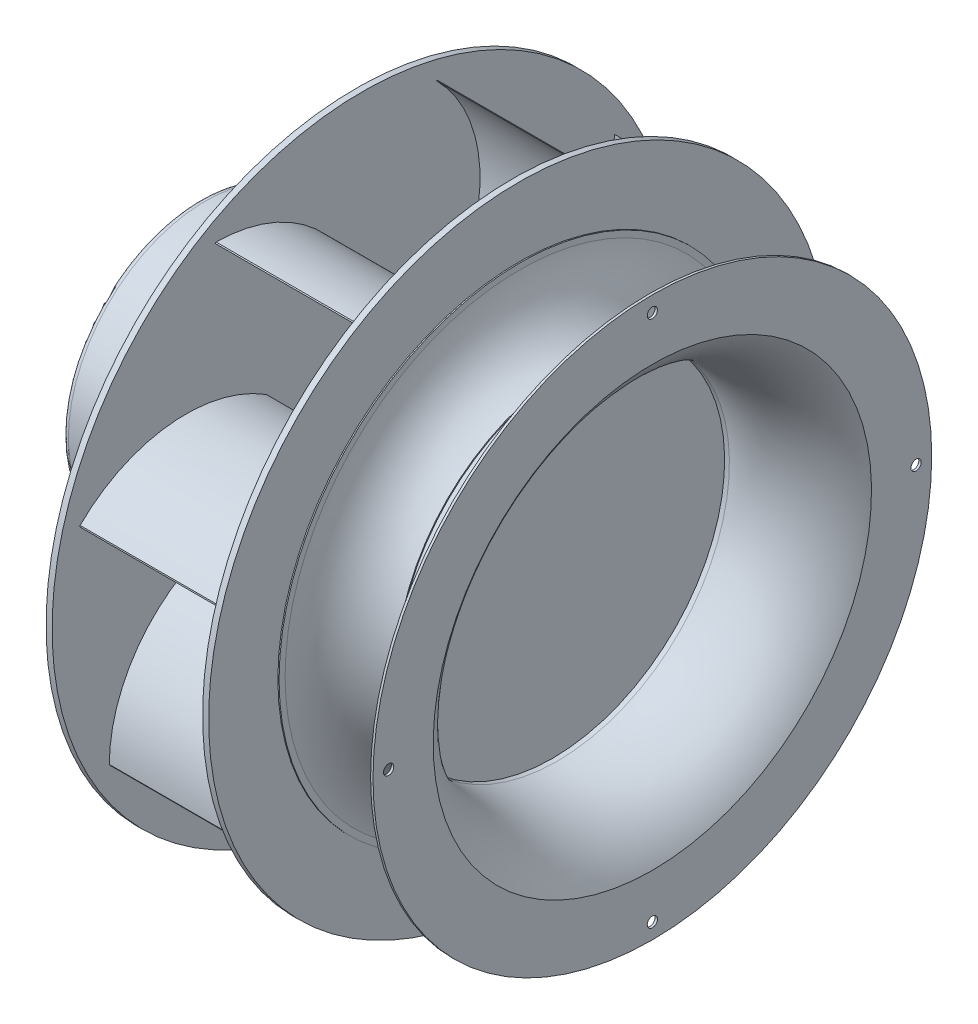
from build123d import *

# Parameters (mm, degrees)
SKETCH2_R         = 257.5
EXTRUDE1_DEPTH    = 5
SKETCH9_R         = 252.5
SKETCH9_R_2       = 100
EXTRUDE7_DEPTH    = 3
SKETCH3_R         = 257.5
EXTRUDE2_DEPTH    = 5
EXTRUDE3_DEPTH    = 130
CIRPATTERN1_COUNT = 8
SKETCH7_R         = 4.25
EXTRUDE5_DEPTH    = 5
CIRPATTERN2_COUNT = 4
SKETCH8_R         = 5
EXTRUDE6_DEPTH    = 90
CIRPATTERN3_COUNT = 8


with BuildPart() as part:
    # Sketch1 → Revolve1 (revolve)
    with BuildSketch(Plane.XY, mode=Mode.PRIVATE) as revolve1_sk:
        with BuildLine():
            Line((0, 0), (0, 109))
            ThreePointArc((0, 109), (1.464466094, 112.535533906), (5, 114))
            Line((5, 114), (70, 114))
            Line((70, 114), (70, 138))
            Line((70, 138), (90, 138))
            Line((90, 138), (90, 98))
            Line((90, 98), (95, 98))
            Line((95, 98), (95, 133))
            Line((95, 133), (105, 133))
            Line((105, 133), (105, 98))
            Line((105, 98), (130, 98))
            Line((130, 98), (130, 0))
            Line((130, 0), (0, 0))
        make_face()
    revolve(revolve1_sk.sketch.rotate(Axis((0, 0, 0), (1, 0, 0)), 90), axis=Axis((0, 0, 0), (1, 0, 0)))

    # Sketch2 → Extrude1 (add)
    with BuildSketch(Plane(origin=(130, 0, 0), x_dir=(0, 0, -1), z_dir=(1, 0, 0))):
        Circle(SKETCH2_R)
    extrude(amount=EXTRUDE1_DEPTH)

    # Sketch9 → Extrude7 (cut)
    with BuildSketch(Plane.ZY.offset(-130)):
        Circle(SKETCH9_R)
        Circle(SKETCH9_R_2, mode=Mode.SUBTRACT)
    extrude(amount=-EXTRUDE7_DEPTH, mode=Mode.SUBTRACT)



with BuildPart() as body_2:
    # Sketch3 → Extrude2 (new body)
    with BuildSketch(Plane(origin=(260, 0, 0), x_dir=(0, 0, -1), z_dir=(1, 0, 0))):
        Circle(SKETCH3_R)
    extrude(amount=EXTRUDE2_DEPTH)


with BuildPart() as part_1:
    add(part.part)

    add(body_2.part)  # Extrude3 merges body 2
    # Sketch4 → Extrude3 (add)
    with BuildSketch(Plane(origin=(135, 0, 0), x_dir=(0, 0, -1), z_dir=(1, 0, 0))):
        with BuildLine():
            Line((-121.25, 210.011160418), (-122.116025404, 209.511160418))
            ThreePointArc((-122.116025404, 209.511160418), (-44.469436379, 181.921031018), (-0.866025404, 112))
            Line((-0.866025404, 112), (0, 112.5))
            ThreePointArc((0, 112.5), (-43.603410976, 182.421031018), (-121.25, 210.011160418))
        make_face()
    extrude3 = extrude(amount=EXTRUDE3_DEPTH)

    # CirPattern1: Extrude3 ×8 about axis
    cirpattern1_axis = Axis((0, 0, 0), (1, 0, 0))
    for i in range(1, CIRPATTERN1_COUNT):
        add(extrude3.rotate(cirpattern1_axis, i * 360 / CIRPATTERN1_COUNT))

    # Sketch5 → Revolve2 (revolve)
    with BuildSketch(Plane.XY, mode=Mode.PRIVATE) as revolve2_sk:
        with BuildLine():
            Line((265, 200), (266, 200))
            Line((266, 200), (266, 195))
            ThreePointArc((266, 195), (280.264553623, 164.150526649), (309, 146))
            Line((309, 146), (309, 145))
            ThreePointArc((309, 145), (279.425239697, 163.334210933), (265, 195))
            Line((265, 195), (265, 200))
        make_face()
    revolve(revolve2_sk.sketch.rotate(Axis((0, 0, 0), (1, 0, 0)), 90), axis=Axis((0, 0, 0), (1, 0, 0)))

    # Sketch8 → Extrude6 (cut)
    with BuildSketch(Plane(origin=(0, 0, 0), x_dir=(0, 0, -1), z_dir=(1, 0, 0))):
        with Locations(Location((0, 126, 0), (0, 0, 180))):
            Circle(SKETCH8_R)
    extrude6 = extrude(amount=EXTRUDE6_DEPTH, mode=Mode.SUBTRACT)

    # CirPattern3: Extrude6 ×8 about axis
    cirpattern3_axis = Axis((0, 0, 0), (1, 0, 0))
    for i in range(1, CIRPATTERN3_COUNT):
        add(extrude6.rotate(cirpattern3_axis, i * 360 / CIRPATTERN3_COUNT), mode=Mode.SUBTRACT)


with BuildPart() as body_2_2:
    # Sketch6 → Revolve3 (revolve)
    with BuildSketch(Plane.XY, mode=Mode.PRIVATE) as revolve3_sk:
        with BuildLine():
            Line((376, 232), (374, 232))
            Line((374, 232), (374, 182))
            ThreePointArc((374, 182), (340.85220133, 152.361635071), (297, 145))
            Line((297, 145), (293, 145))
            Line((293, 145), (293, 143))
            Line((293, 143), (297, 143))
            ThreePointArc((297, 143), (342.352293074, 150.645355054), (376, 182))
            Line((376, 182), (376, 232))
        make_face()
    revolve(revolve3_sk.sketch.rotate(Axis((0, 0, 0), (1, 0, 0)), 180), axis=Axis((0, 0, 0), (1, 0, 0)))

    # Sketch7 → Extrude5 (cut)
    with BuildSketch(Plane(origin=(376, 0, 0), x_dir=(0, 0, -1), z_dir=(1, 0, 0))):
        with Locations((0, 219)):
            Circle(SKETCH7_R)
    extrude5 = extrude(amount=-EXTRUDE5_DEPTH, mode=Mode.SUBTRACT)

    # CirPattern2: Extrude5 ×4 about axis
    cirpattern2_axis = Axis((0, 0, 0), (1, 0, 0))
    for i in range(1, CIRPATTERN2_COUNT):
        add(extrude5.rotate(cirpattern2_axis, i * 360 / CIRPATTERN2_COUNT), mode=Mode.SUBTRACT)


solid = Compound([part_1.part, body_2_2.part])
